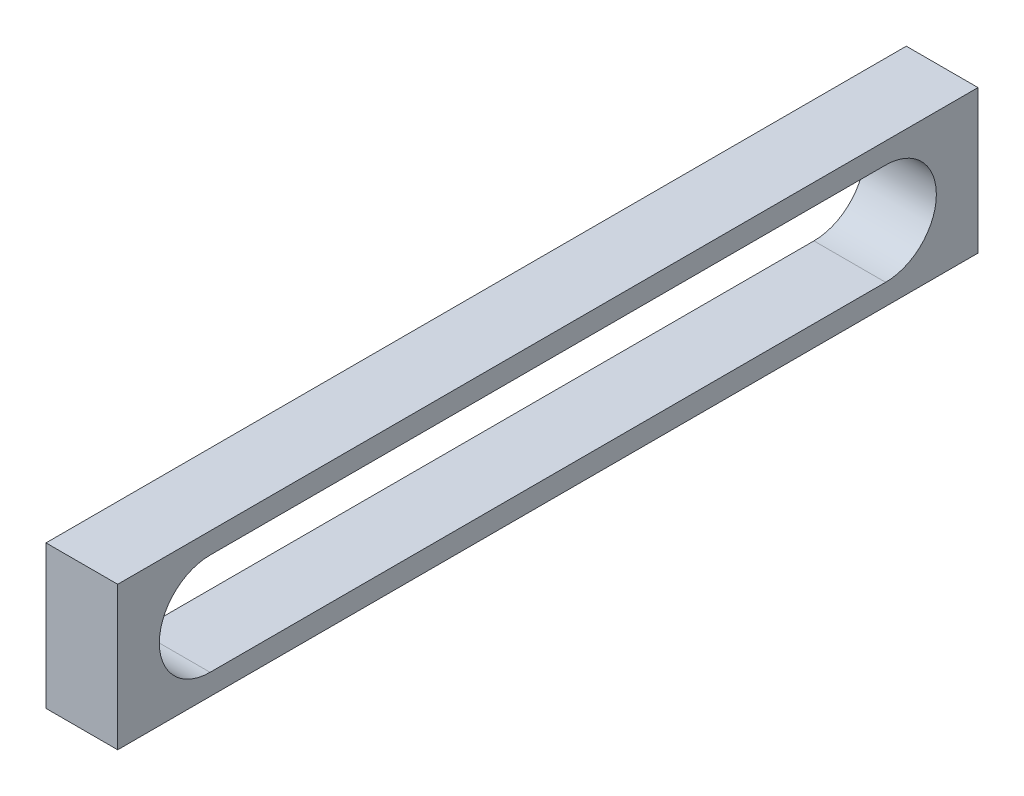
from build123d import *

# Parameters (mm, degrees)
SKETCH1_W           = 152.4
SKETCH1_H           = 25.4
BOSS_EXTRUDE1_DEPTH = 12.7
CUT_EXTRUDE2_REACH  = 156.654


with BuildPart() as part:
    # Sketch1 → Boss-Extrude1 (new body)
    with BuildSketch(Plane(origin=(0, 0, 0), x_dir=(0, 0, -1), z_dir=(1, 0, 0))):
        with Locations((-76.2, 12.7)):
            Rectangle(SKETCH1_W, SKETCH1_H)
    extrude(amount=BOSS_EXTRUDE1_DEPTH)

    # Sketch3 → Cut-Extrude2 (cut, up to next)
    with BuildSketch(Plane(origin=(12.7, 2.360975137, 0), x_dir=(0, 0, -1), z_dir=(1, 0, 0)), mode=Mode.PRIVATE) as cut_extrude2_sk1:
        with BuildLine():
            Line((-136.033448355, 19.329867732), (-16.366551645, 19.329867732))
            ThreePointArc((-16.366551645, 19.329867732), (-7.375708776, 10.339024863), (-16.366551645, 1.348181995))
            Line((-16.366551645, 1.348181995), (-136.033448355, 1.348181995))
            ThreePointArc((-136.033448355, 1.348181995), (-145.024291224, 10.339024863), (-136.033448355, 19.329867732))
        make_face()
    cut_extrude2_tool1 = extrude(cut_extrude2_sk1.sketch, amount=-CUT_EXTRUDE2_REACH, mode=Mode.PRIVATE) & part.part
    add(cut_extrude2_tool1.solids().sort_by_distance((12.7, 12.7, 76.2))[0], mode=Mode.SUBTRACT)


solid = part.part
